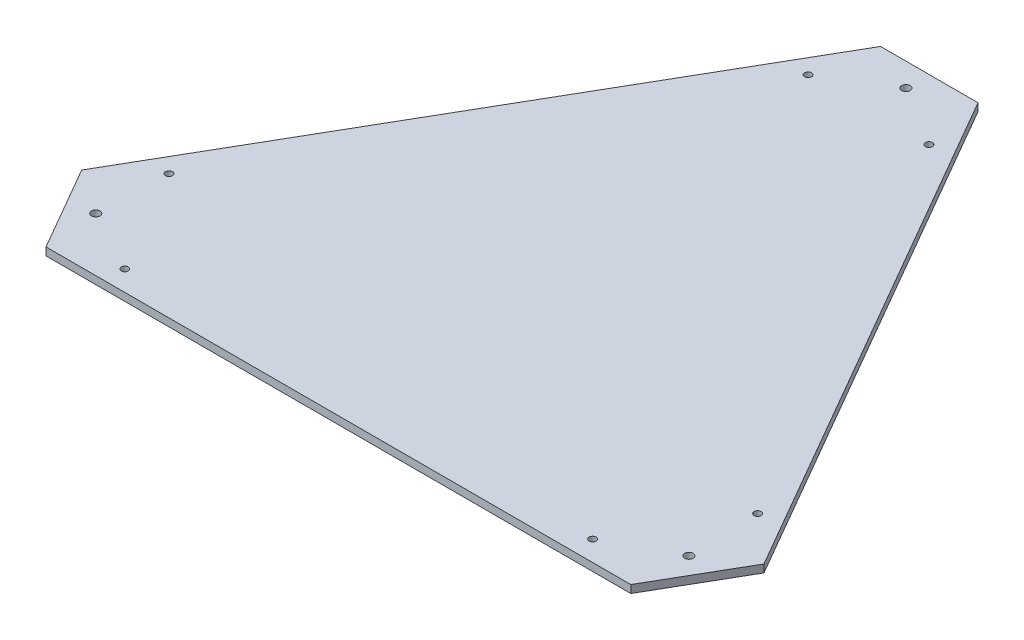
from build123d import *

# Parameters (mm, degrees)
BOSS_EXTRU_1_DEPTH           = 5
ENL_V_MAT_EXTRU_1_REACH      = 322.764
ESQUISSE2_R                  = 2.75
ENL_V_MAT_EXTRU_4_REACH      = 322.764
ESQUISSE6_R                  = 2.25
R_P_TITION_CIRCULAIRE2_COUNT = 3


with BuildPart() as part:
    # Esquisse1 → Boss.-Extru.1 (new body)
    with BuildSketch(Plane(origin=(0, 0, 0), x_dir=(1, 0, 0), z_dir=(0, 1, 0))):
        Polygon((-31.25, 234.548546858), (31.25, 234.548546858), (218.75, -90.210979561), (187.5, -144.337567297), (-187.5, -144.337567297), (-218.75, -90.210979561), align=None)
    extrude(amount=BOSS_EXTRU_1_DEPTH)

    # Esquisse2 → Enlèv. mat.-Extru.1 (cut, up to next)
    with BuildSketch(Plane(origin=(0, 5, 0), x_dir=(1, 0, 0), z_dir=(0, 1, 0)), mode=Mode.PRIVATE) as enl_v_mat_extru_1_sk1:
        with Locations((0, 219.548546858)):
            Circle(ESQUISSE2_R)
    enl_v_mat_extru_1_tool1 = extrude(enl_v_mat_extru_1_sk1.sketch, amount=-ENL_V_MAT_EXTRU_1_REACH, mode=Mode.PRIVATE) & part.part
    # Esquisse2 → Enlèv. mat.-Extru.1 (cut, up to next)
    with BuildSketch(Plane(origin=(0, 5, 0), x_dir=(1, 0, 0), z_dir=(0, 1, 0)), mode=Mode.PRIVATE) as enl_v_mat_extru_1_sk2:
        with Locations((-190.134618943, -109.774273429)):
            Circle(ESQUISSE2_R)
    enl_v_mat_extru_1_tool2 = extrude(enl_v_mat_extru_1_sk2.sketch, amount=-ENL_V_MAT_EXTRU_1_REACH, mode=Mode.PRIVATE) & part.part
    # Esquisse2 → Enlèv. mat.-Extru.1 (cut, up to next)
    with BuildSketch(Plane(origin=(0, 5, 0), x_dir=(1, 0, 0), z_dir=(0, 1, 0)), mode=Mode.PRIVATE) as enl_v_mat_extru_1_sk3:
        with Locations((190.134618943, -109.774273429)):
            Circle(ESQUISSE2_R)
    enl_v_mat_extru_1_tool3 = extrude(enl_v_mat_extru_1_sk3.sketch, amount=-ENL_V_MAT_EXTRU_1_REACH, mode=Mode.PRIVATE) & part.part
    add(enl_v_mat_extru_1_tool1.solids().sort_by_distance((0, 5, -219.548547))[0], mode=Mode.SUBTRACT)
    add(enl_v_mat_extru_1_tool2.solids().sort_by_distance((-190.134619, 5, 109.774273))[0], mode=Mode.SUBTRACT)
    add(enl_v_mat_extru_1_tool3.solids().sort_by_distance((190.134619, 5, 109.774273))[0], mode=Mode.SUBTRACT)

    # Esquisse6 → Enlèv. mat.-Extru.4 (cut, up to next)
    with BuildSketch(Plane(origin=(0, 5, 0), x_dir=(1, 0, 0), z_dir=(0, 1, 0)), mode=Mode.PRIVATE) as enl_v_mat_extru_4_sk1:
        with Locations((-150, -131.337567297)):
            Circle(ESQUISSE6_R)
    enl_v_mat_extru_4_tool1 = extrude(enl_v_mat_extru_4_sk1.sketch, amount=-ENL_V_MAT_EXTRU_4_REACH, mode=Mode.PRIVATE) & part.part
    # Esquisse6 → Enlèv. mat.-Extru.4 (cut, up to next)
    with BuildSketch(Plane(origin=(0, 5, 0), x_dir=(1, 0, 0), z_dir=(0, 1, 0)), mode=Mode.PRIVATE) as enl_v_mat_extru_4_sk2:
        with Locations((150, -131.337567297)):
            Circle(ESQUISSE6_R)
    enl_v_mat_extru_4_tool2 = extrude(enl_v_mat_extru_4_sk2.sketch, amount=-ENL_V_MAT_EXTRU_4_REACH, mode=Mode.PRIVATE) & part.part
    enl_v_mat_extru_4_1 = enl_v_mat_extru_4_tool1.solids().sort_by_distance((-150, 5, 131.337567))[0]
    add(enl_v_mat_extru_4_1, mode=Mode.SUBTRACT)
    enl_v_mat_extru_4_2 = enl_v_mat_extru_4_tool2.solids().sort_by_distance((150, 5, 131.337567))[0]
    add(enl_v_mat_extru_4_2, mode=Mode.SUBTRACT)
    enl_v_mat_extru_4 = enl_v_mat_extru_4_1 + enl_v_mat_extru_4_2  # Enlèv. mat.-Extru.4 as one shape, for the pattern or mirror that repeats it

    # Répétition circulaire2: Enlèv. mat.-Extru.4 ×3 about axis
    r_p_tition_circulaire2_axis = Axis((0, -0.25, 0), (0, 1, 0))
    for i in range(1, R_P_TITION_CIRCULAIRE2_COUNT):
        add(enl_v_mat_extru_4.rotate(r_p_tition_circulaire2_axis, i * 360 / R_P_TITION_CIRCULAIRE2_COUNT), mode=Mode.SUBTRACT)


solid = part.part
